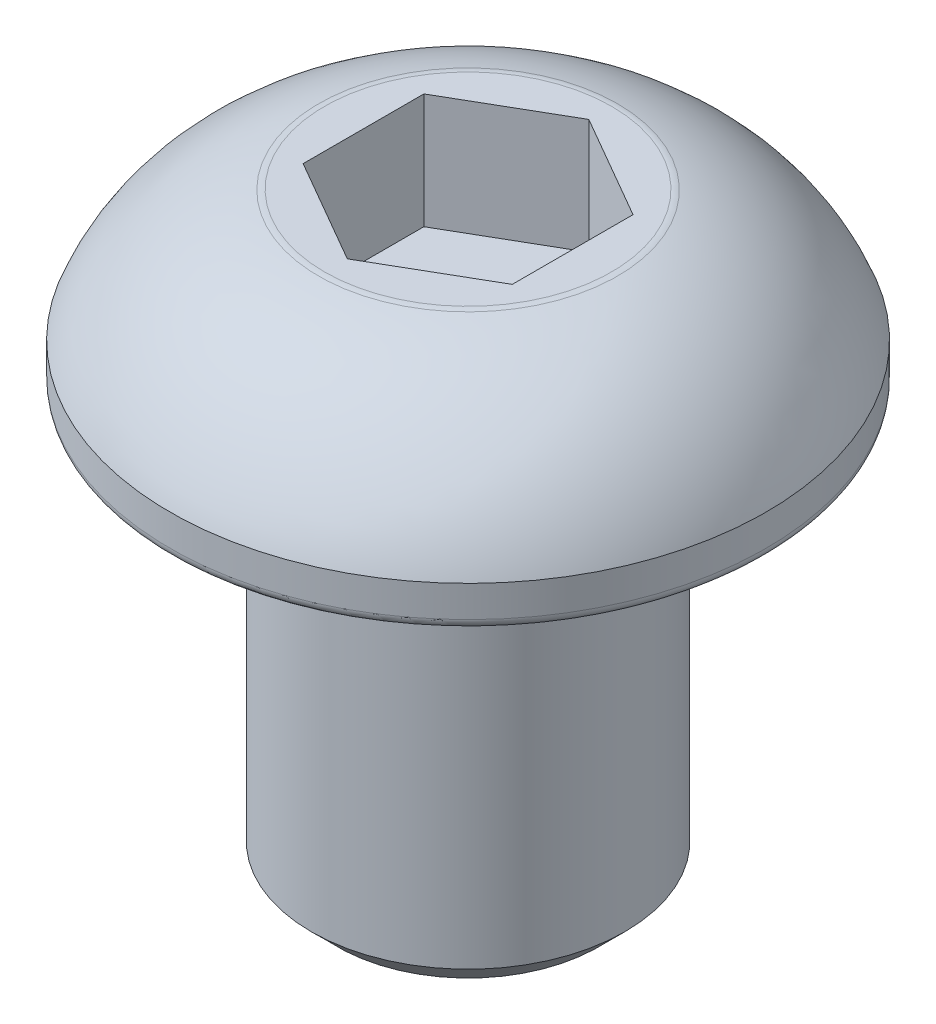
from build123d import *

# Parameters (mm, degrees)
CUT_EXTRUDE1_DEPTH = 1.1


with BuildPart() as part:
    # Sketch1 → Revolve1 (revolve)
    with BuildSketch(Plane.XY, mode=Mode.PRIVATE) as revolve1_sk:
        with BuildLine():
            Line((-1.5, -0.1), (-1.5, -3.75))
            Line((-1.5, -3.75), (-1.25, -4))
            Line((-1.25, -4), (0, -4))
            Line((0, -4), (0, 1.65))
            Line((0, 1.65), (-1.372450351, 1.65))
            ThreePointArc((-1.372450351, 1.65), (-1.400779398, 1.648389744), (-1.42874351, 1.643579721))
            ThreePointArc((-1.42874351, 1.643579721), (-2.295395633, 1.200105689), (-2.85, 0.4))
            Line((-2.85, 0.4), (-2.85, 0.1))
            ThreePointArc((-2.85, 0.1), (-2.820710678, 0.029289322), (-2.75, 0))
            Line((-2.75, 0), (-1.6, 0))
            ThreePointArc((-1.6, 0), (-1.529289322, -0.029289322), (-1.5, -0.1))
        make_face()
    revolve(revolve1_sk.sketch.rotate(Axis((0, -4, 0), (0, 1, 0)), 270), axis=Axis((0, -4, 0), (0, 1, 0)))

    # Sketch2 → Cut-Extrude1 (cut)
    with BuildSketch(Plane(origin=(0, 1.65, 0), x_dir=(1, 0, 0), z_dir=(0, 1, 0))):
        Polygon((-1, 0.577350269), (-1, -0.577350269), (0, -1.154700538), (1, -0.577350269), (1, 0.577350269), (0, 1.154700538), align=None)
    extrude(amount=-CUT_EXTRUDE1_DEPTH, mode=Mode.SUBTRACT)


solid = part.part
